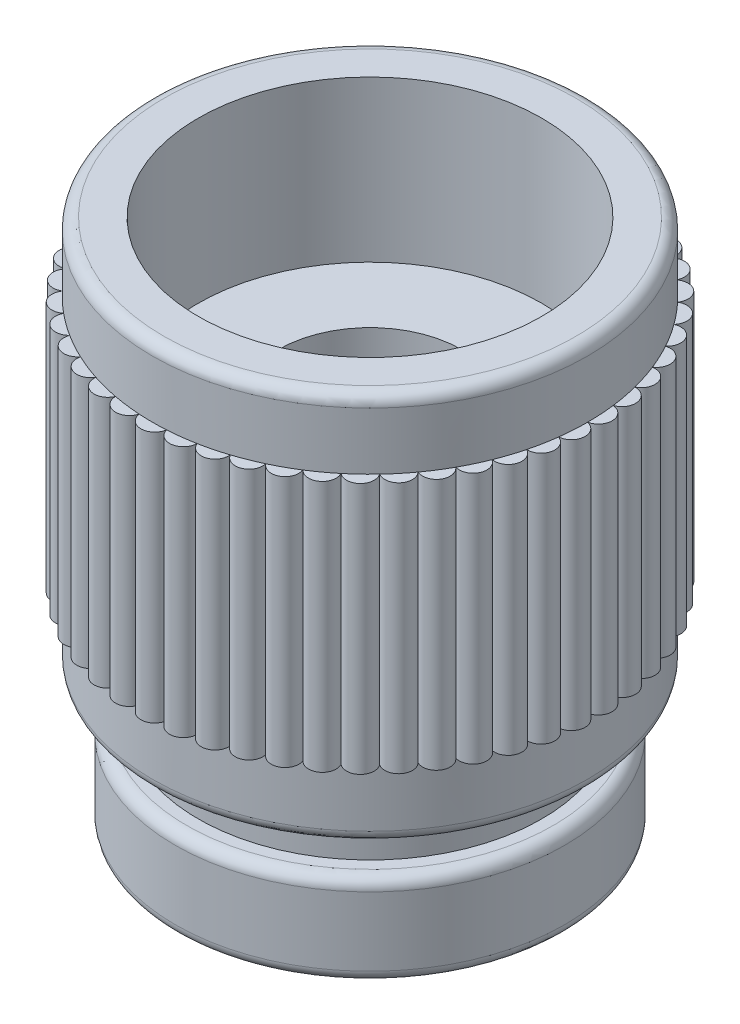
from build123d import *

# Parameters (mm, degrees)
BOSS_EXTRU_1_DEPTH = 2.75


with BuildPart() as part:
    # Esquisse1 → Révolution1 (revolve)
    with BuildSketch(Plane.XY, mode=Mode.PRIVATE) as r_volution1_sk:
        with BuildLine():
            Line((3.75, 8.5), (4.5, 8.5))
            ThreePointArc((4.5, 8.5), (4.676776695, 8.426776695), (4.75, 8.25))
            Line((4.75, 8.25), (4.75, 0.25))
            ThreePointArc((4.75, 0.25), (4.676776695, 0.073223305), (4.5, 0))
            Line((4.5, 0), (3.75, 0))
            Line((3.75, 0), (3.75, -1))
            Line((3.75, -1), (4, -1))
            ThreePointArc((4, -1), (4.176776695, -1.073223305), (4.25, -1.25))
            Line((4.25, -1.25), (4.25, -2.75))
            ThreePointArc((4.25, -2.75), (4.176776695, -2.926776695), (4, -3))
            Line((4, -3), (2.25, -3))
            ThreePointArc((2.25, -3), (2.073223305, -2.926776695), (2, -2.75))
            Line((2, -2.75), (2, 5))
            Line((2, 5), (3.75, 5))
            Line((3.75, 5), (3.75, 8.5))
        make_face()
    revolve(r_volution1_sk.sketch.rotate(Axis((0, 0, 0), (0, 1, 0)), 90), axis=Axis((0, 0, 0), (0, 1, 0)))

    # Esquisse2 → Boss.-Extru.1 (add, symmetric)
    with BuildSketch(Plane(origin=(0, 4.25, 0), x_dir=(1, 0, 0), z_dir=(0, 1, 0))):
        with BuildLine():
            ThreePointArc((-0.297227527, 4.740691489), (0, 5), (0.297227527, 4.740691489))
            ThreePointArc((0.297227527, 4.740691489), (0, 4.75), (-0.297227527, 4.740691489))
        make_face()
        with BuildLine():
            ThreePointArc((0.299282395, 4.740562208), (0.626666168, 4.960573507), (0.889049993, 4.666057234))
            ThreePointArc((0.889049993, 4.666057234), (0.595332859, 4.712544831), (0.299282395, 4.740562208))
        make_face()
        with BuildLine():
            ThreePointArc((0.891072454, 4.665671429), (1.243449436, 4.842915806), (1.466851609, 4.517836469))
            ThreePointArc((1.466851609, 4.517836469), (1.181276964, 4.600770015), (0.891072454, 4.665671429))
        make_face()
        with BuildLine():
            ThreePointArc((1.468809769, 4.517200224), (1.840622763, 4.648882429), (2.021520099, 4.298366723))
            ThreePointArc((2.021520099, 4.298366723), (1.748591625, 4.416438308), (1.468809769, 4.517200224))
        make_face()
        with BuildLine():
            ThreePointArc((2.023383076, 4.297490073), (2.408768371, 4.3815334), (2.54430801, 4.011109167))
            ThreePointArc((2.54430801, 4.011109167), (2.288329952, 4.16245673), (2.023383076, 4.297490073))
        make_face()
        with BuildLine():
            ThreePointArc((2.546046423, 4.010005937), (2.938926261, 4.045084972), (3.026970664, 3.660594023))
            ThreePointArc((3.026970664, 3.660594023), (2.791979948, 3.842830723), (2.546046423, 4.010005937))
        make_face()
        with BuildLine():
            ThreePointArc((3.028557097, 3.659281611), (3.42273553, 3.644843137), (3.461896181, 3.252349125))
            ThreePointArc((3.461896181, 3.252349125), (3.251598753, 3.46260098), (3.028557097, 3.659281611))
        make_face()
        with BuildLine():
            ThreePointArc((3.463305616, 3.250848229), (3.852566214, 3.187119949), (3.842225528, 2.792812738))
            ThreePointArc((3.842225528, 2.792812738), (3.659937903, 3.027763951), (3.463305616, 3.250848229))
        make_face()
        with BuildLine():
            ThreePointArc((3.843435738, 2.791147028), (4.221639628, 2.679133975), (4.161960684, 2.289232026))
            ThreePointArc((4.161960684, 2.289232026), (4.010557646, 2.545177276), (3.843435738, 2.791147028))
        make_face()
        with BuildLine():
            ThreePointArc((4.162952581, 2.287427771), (4.524135262, 2.128896458), (4.416059233, 1.749548757))
            ThreePointArc((4.416059233, 1.749548757), (4.297928499, 2.022451635), (4.162952581, 2.287427771))
        make_face()
        with BuildLine():
            ThreePointArc((4.416817176, 1.747634411), (4.755282581, 1.545084972), (4.60051389, 1.182274059))
            ThreePointArc((4.60051389, 1.182274059), (4.517518452, 1.467830723), (4.416817176, 1.747634411))
        make_face()
        with BuildLine():
            ThreePointArc((4.601025925, 1.180279813), (4.911436254, 0.936906573), (4.712415694, 0.596354193))
            ThreePointArc((4.712415694, 0.596354193), (4.665864441, 0.890061244), (4.601025925, 1.180279813))
        make_face()
        with BuildLine():
            ThreePointArc((4.712673747, 0.594311498), (4.990133642, 0.313952598), (4.749999888, 0.001029465))
            ThreePointArc((4.749999888, 0.001029465), (4.74062696, 0.298254968), (4.712673747, 0.594311498))
        make_face()
        with BuildLine():
            ThreePointArc((4.749999888, -0.001029465), (4.990133642, -0.313952598), (4.712673747, -0.594311498))
            ThreePointArc((4.712673747, -0.594311498), (4.74062696, -0.298254968), (4.749999888, -0.001029465))
        make_face()
        with BuildLine():
            ThreePointArc((4.712415694, -0.596354193), (4.911436254, -0.936906573), (4.601025925, -1.180279813))
            ThreePointArc((4.601025925, -1.180279813), (4.665864441, -0.890061244), (4.712415694, -0.596354193))
        make_face()
        with BuildLine():
            ThreePointArc((4.60051389, -1.182274059), (4.755282581, -1.545084972), (4.416817176, -1.747634411))
            ThreePointArc((4.416817176, -1.747634411), (4.517518452, -1.467830723), (4.60051389, -1.182274059))
        make_face()
        with BuildLine():
            ThreePointArc((4.416059233, -1.749548757), (4.524135262, -2.128896458), (4.162952581, -2.287427771))
            ThreePointArc((4.162952581, -2.287427771), (4.297928499, -2.022451635), (4.416059233, -1.749548757))
        make_face()
        with BuildLine():
            ThreePointArc((4.161960684, -2.289232026), (4.221639628, -2.679133975), (3.843435738, -2.791147028))
            ThreePointArc((3.843435738, -2.791147028), (4.010557646, -2.545177276), (4.161960684, -2.289232026))
        make_face()
        with BuildLine():
            ThreePointArc((3.842225528, -2.792812738), (3.852566214, -3.187119949), (3.463305616, -3.250848229))
            ThreePointArc((3.463305616, -3.250848229), (3.659937903, -3.027763951), (3.842225528, -2.792812738))
        make_face()
        with BuildLine():
            ThreePointArc((3.461896181, -3.252349125), (3.42273553, -3.644843137), (3.028557097, -3.659281611))
            ThreePointArc((3.028557097, -3.659281611), (3.251598753, -3.46260098), (3.461896181, -3.252349125))
        make_face()
        with BuildLine():
            ThreePointArc((3.026970664, -3.660594023), (2.938926261, -4.045084972), (2.546046423, -4.010005937))
            ThreePointArc((2.546046423, -4.010005937), (2.791979948, -3.842830723), (3.026970664, -3.660594023))
        make_face()
        with BuildLine():
            ThreePointArc((2.54430801, -4.011109167), (2.408768371, -4.3815334), (2.023383076, -4.297490073))
            ThreePointArc((2.023383076, -4.297490073), (2.288329952, -4.16245673), (2.54430801, -4.011109167))
        make_face()
        with BuildLine():
            ThreePointArc((2.021520099, -4.298366723), (1.840622763, -4.648882429), (1.468809769, -4.517200224))
            ThreePointArc((1.468809769, -4.517200224), (1.748591625, -4.416438308), (2.021520099, -4.298366723))
        make_face()
        with BuildLine():
            ThreePointArc((1.466851609, -4.517836469), (1.243449436, -4.842915806), (0.891072454, -4.665671429))
            ThreePointArc((0.891072454, -4.665671429), (1.181276964, -4.600770015), (1.466851609, -4.517836469))
        make_face()
        with BuildLine():
            ThreePointArc((0.889049993, -4.666057234), (0.626666168, -4.960573507), (0.299282395, -4.740562208))
            ThreePointArc((0.299282395, -4.740562208), (0.595332859, -4.712544831), (0.889049993, -4.666057234))
        make_face()
        with BuildLine():
            ThreePointArc((0.297227527, -4.740691489), (0, -5), (-0.297227527, -4.740691489))
            ThreePointArc((-0.297227527, -4.740691489), (0, -4.75), (0.297227527, -4.740691489))
        make_face()
        with BuildLine():
            ThreePointArc((-0.299282395, -4.740562208), (-0.626666168, -4.960573507), (-0.889049993, -4.666057234))
            ThreePointArc((-0.889049993, -4.666057234), (-0.595332859, -4.712544831), (-0.299282395, -4.740562208))
        make_face()
        with BuildLine():
            ThreePointArc((-0.891072454, -4.665671429), (-1.243449436, -4.842915806), (-1.466851609, -4.517836469))
            ThreePointArc((-1.466851609, -4.517836469), (-1.181276964, -4.600770015), (-0.891072454, -4.665671429))
        make_face()
        with BuildLine():
            ThreePointArc((-1.468809769, -4.517200224), (-1.840622763, -4.648882429), (-2.021520099, -4.298366723))
            ThreePointArc((-2.021520099, -4.298366723), (-1.748591625, -4.416438308), (-1.468809769, -4.517200224))
        make_face()
        with BuildLine():
            ThreePointArc((-2.023383076, -4.297490073), (-2.408768371, -4.3815334), (-2.54430801, -4.011109167))
            ThreePointArc((-2.54430801, -4.011109167), (-2.288329952, -4.16245673), (-2.023383076, -4.297490073))
        make_face()
        with BuildLine():
            ThreePointArc((-2.546046423, -4.010005937), (-2.938926261, -4.045084972), (-3.026970664, -3.660594023))
            ThreePointArc((-3.026970664, -3.660594023), (-2.791979948, -3.842830723), (-2.546046423, -4.010005937))
        make_face()
        with BuildLine():
            ThreePointArc((-3.028557097, -3.659281611), (-3.42273553, -3.644843137), (-3.461896181, -3.252349125))
            ThreePointArc((-3.461896181, -3.252349125), (-3.251598753, -3.46260098), (-3.028557097, -3.659281611))
        make_face()
        with BuildLine():
            ThreePointArc((-3.463305616, -3.250848229), (-3.852566214, -3.187119949), (-3.842225528, -2.792812738))
            ThreePointArc((-3.842225528, -2.792812738), (-3.659937903, -3.027763951), (-3.463305616, -3.250848229))
        make_face()
        with BuildLine():
            ThreePointArc((-3.843435738, -2.791147028), (-4.221639628, -2.679133975), (-4.161960684, -2.289232026))
            ThreePointArc((-4.161960684, -2.289232026), (-4.010557646, -2.545177276), (-3.843435738, -2.791147028))
        make_face()
        with BuildLine():
            ThreePointArc((-4.162952581, -2.287427771), (-4.524135262, -2.128896458), (-4.416059233, -1.749548757))
            ThreePointArc((-4.416059233, -1.749548757), (-4.297928499, -2.022451635), (-4.162952581, -2.287427771))
        make_face()
        with BuildLine():
            ThreePointArc((-4.416817176, -1.747634411), (-4.755282581, -1.545084972), (-4.60051389, -1.182274059))
            ThreePointArc((-4.60051389, -1.182274059), (-4.517518452, -1.467830723), (-4.416817176, -1.747634411))
        make_face()
        with BuildLine():
            ThreePointArc((-4.601025925, -1.180279813), (-4.911436254, -0.936906573), (-4.712415694, -0.596354193))
            ThreePointArc((-4.712415694, -0.596354193), (-4.665864441, -0.890061244), (-4.601025925, -1.180279813))
        make_face()
        with BuildLine():
            ThreePointArc((-4.712673747, -0.594311498), (-4.990133642, -0.313952598), (-4.749999888, -0.001029465))
            ThreePointArc((-4.749999888, -0.001029465), (-4.74062696, -0.298254968), (-4.712673747, -0.594311498))
        make_face()
        with BuildLine():
            ThreePointArc((-4.749999888, 0.001029465), (-4.990133642, 0.313952598), (-4.712673747, 0.594311498))
            ThreePointArc((-4.712673747, 0.594311498), (-4.74062696, 0.298254968), (-4.749999888, 0.001029465))
        make_face()
        with BuildLine():
            ThreePointArc((-4.712415694, 0.596354193), (-4.911436254, 0.936906573), (-4.601025925, 1.180279813))
            ThreePointArc((-4.601025925, 1.180279813), (-4.665864441, 0.890061244), (-4.712415694, 0.596354193))
        make_face()
        with BuildLine():
            ThreePointArc((-4.60051389, 1.182274059), (-4.755282581, 1.545084972), (-4.416817176, 1.747634411))
            ThreePointArc((-4.416817176, 1.747634411), (-4.517518452, 1.467830723), (-4.60051389, 1.182274059))
        make_face()
        with BuildLine():
            ThreePointArc((-4.416059233, 1.749548757), (-4.524135262, 2.128896458), (-4.162952581, 2.287427771))
            ThreePointArc((-4.162952581, 2.287427771), (-4.297928499, 2.022451635), (-4.416059233, 1.749548757))
        make_face()
        with BuildLine():
            ThreePointArc((-4.161960684, 2.289232026), (-4.221639628, 2.679133975), (-3.843435738, 2.791147028))
            ThreePointArc((-3.843435738, 2.791147028), (-4.010557646, 2.545177276), (-4.161960684, 2.289232026))
        make_face()
        with BuildLine():
            ThreePointArc((-3.842225528, 2.792812738), (-3.852566214, 3.187119949), (-3.463305616, 3.250848229))
            ThreePointArc((-3.463305616, 3.250848229), (-3.659937903, 3.027763951), (-3.842225528, 2.792812738))
        make_face()
        with BuildLine():
            ThreePointArc((-3.461896181, 3.252349125), (-3.42273553, 3.644843137), (-3.028557097, 3.659281611))
            ThreePointArc((-3.028557097, 3.659281611), (-3.251598753, 3.46260098), (-3.461896181, 3.252349125))
        make_face()
        with BuildLine():
            ThreePointArc((-3.026970664, 3.660594023), (-2.938926261, 4.045084972), (-2.546046423, 4.010005937))
            ThreePointArc((-2.546046423, 4.010005937), (-2.791979948, 3.842830723), (-3.026970664, 3.660594023))
        make_face()
        with BuildLine():
            ThreePointArc((-2.54430801, 4.011109167), (-2.408768371, 4.3815334), (-2.023383076, 4.297490073))
            ThreePointArc((-2.023383076, 4.297490073), (-2.288329952, 4.16245673), (-2.54430801, 4.011109167))
        make_face()
        with BuildLine():
            ThreePointArc((-2.021520099, 4.298366723), (-1.840622763, 4.648882429), (-1.468809769, 4.517200224))
            ThreePointArc((-1.468809769, 4.517200224), (-1.748591625, 4.416438308), (-2.021520099, 4.298366723))
        make_face()
        with BuildLine():
            ThreePointArc((-1.466851609, 4.517836469), (-1.243449436, 4.842915806), (-0.891072454, 4.665671429))
            ThreePointArc((-0.891072454, 4.665671429), (-1.181276964, 4.600770015), (-1.466851609, 4.517836469))
        make_face()
        with BuildLine():
            ThreePointArc((-0.889049993, 4.666057234), (-0.626666168, 4.960573507), (-0.299282395, 4.740562208))
            ThreePointArc((-0.299282395, 4.740562208), (-0.595332859, 4.712544831), (-0.889049993, 4.666057234))
        make_face()
    extrude(amount=BOSS_EXTRU_1_DEPTH, both=True)


solid = part.part
